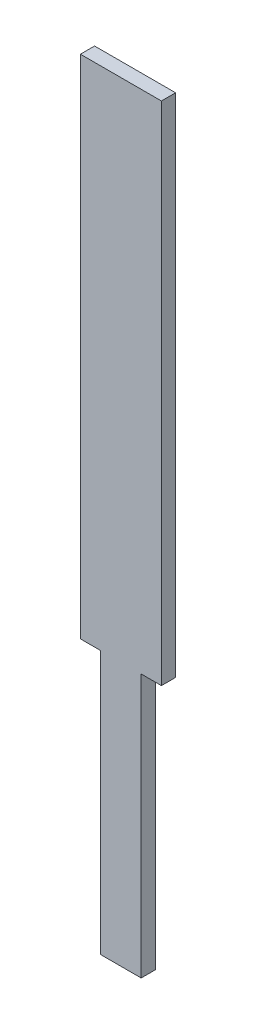
from build123d import *

# Parameters (mm, degrees)
SKETCH1_W           = 40
SKETCH1_H           = 250
SKETCH1_W_2         = 20
SKETCH1_H_2         = 130
BOSS_EXTRUDE1_DEPTH = 7


with BuildPart() as part:
    # Sketch1 → Boss-Extrude1 (new body)
    with BuildSketch(Plane.XY):
        Rectangle(SKETCH1_W, SKETCH1_H)
        with Locations((0, -190)):
            Rectangle(SKETCH1_W_2, SKETCH1_H_2)
    extrude(amount=BOSS_EXTRUDE1_DEPTH)


solid = part.part
